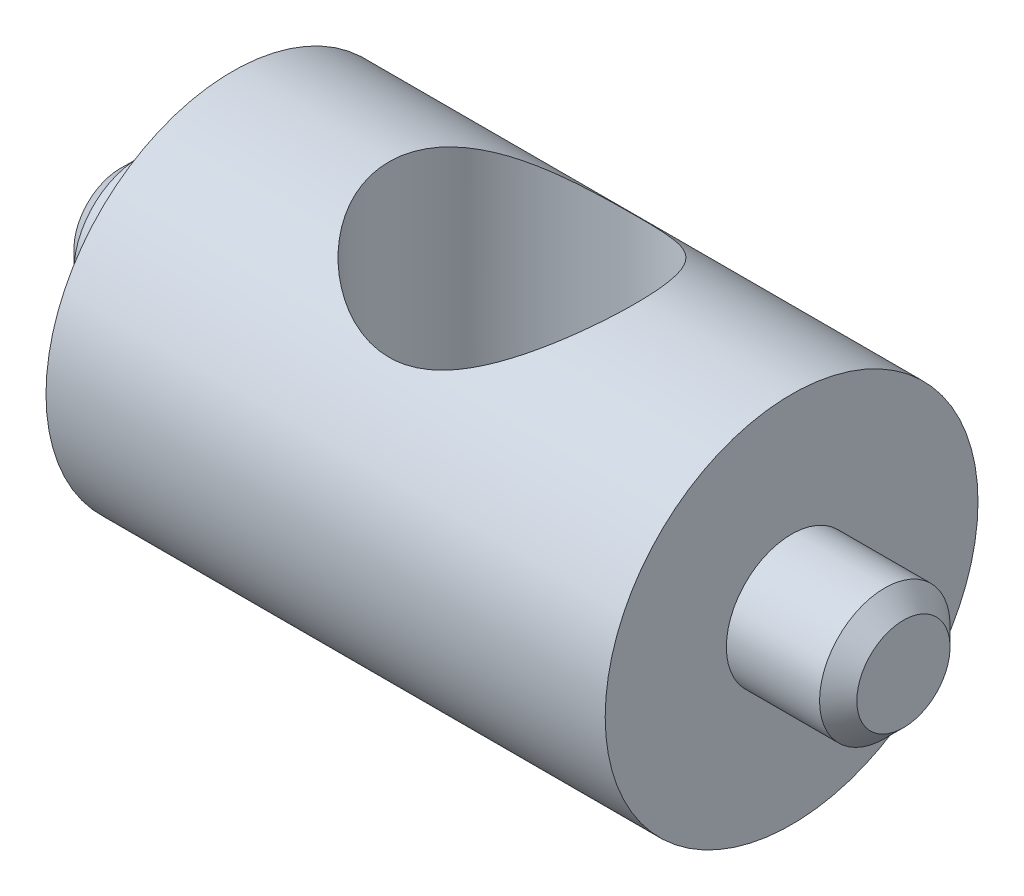
from build123d import *

# Parameters (mm, degrees)
SMUSSO1_SIZE         = 0.5
FORO_PER_VITE_M6_2_D = 6.6


with BuildPart() as part:
    # Schizzo1 → Rivoluzione1 (revolve)
    with BuildSketch(Plane.XY, mode=Mode.PRIVATE) as rivoluzione1_sk:
        Polygon((-21, 0), (-21, 1.75), (-18, 1.75), (-18, 5), (-3, 5), (-3, 1.75), (0, 1.75), (0, 0), align=None)
    revolve(rivoluzione1_sk.sketch.rotate(Axis((-35.932586733, 0, 0), (1, 0, 0)), 90), axis=Axis((-35.932586733, 0, 0), (1, 0, 0)))

    # Smusso1
    smusso1_edges = [part.edges().sort_by_distance(p)[0] for p in [
        (0, 0, -1.75),
        (-21, 0, -1.75),
    ]]
    chamfer(smusso1_edges, length=SMUSSO1_SIZE)

    # Foro per Vite M6-2 (through all)
    with Locations(Plane(origin=(-10.5, 5, 0), x_dir=(0, 0, 1), z_dir=(0, 1, 0))):
        with Locations((0, 0)):
            Hole(FORO_PER_VITE_M6_2_D / 2)


solid = part.part
